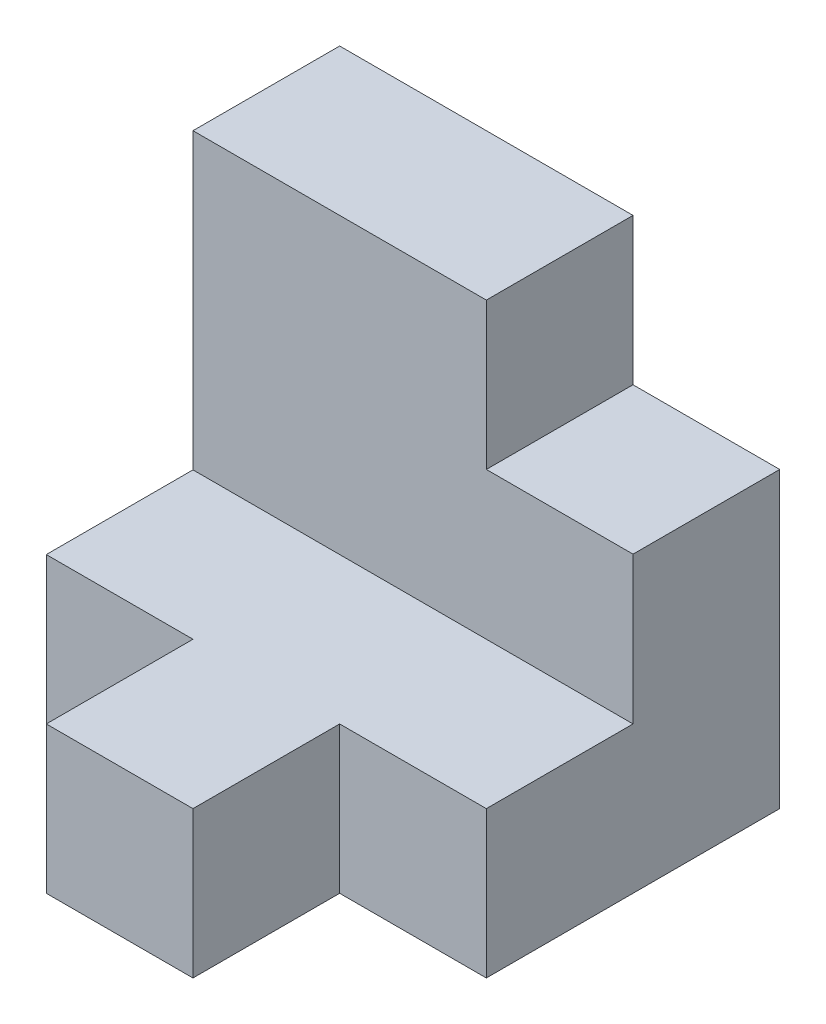
from build123d import *

# Parameters (mm, degrees)
ESBO_O2_W                = 60
ESBO_O2_H                = 20
RESSALTO_EXTRUS_O1_DEPTH = 40
ESBO_O4_W                = 20
ESBO_O4_H                = 20
CORTE_EXTRUS_O1_DEPTH    = 40
ESBO_O5_W                = 20
ESBO_O5_H                = 20
CORTE_EXTRUS_O2_DEPTH    = 40
ESBO_O7_W                = 60
ESBO_O7_H                = 40.049473908
RESSALTO_EXTRUS_O2_DEPTH = 20
ESBO_O8_W                = 40
ESBO_O8_H                = 20
RESSALTO_EXTRUS_O3_DEPTH = 20


with BuildPart() as part:
    # Esboço2 → Ressalto-extrusão1 (new body)
    with BuildSketch(Plane.XY):
        with Locations((30, 10)):
            Rectangle(ESBO_O2_W, ESBO_O2_H)
    extrude(amount=RESSALTO_EXTRUS_O1_DEPTH)

    # Esboço4 → Corte-extrusão1 (cut)
    with BuildSketch(Plane(origin=(0, 20, 0), x_dir=(1, 0, 0), z_dir=(0, 1, 0))):
        with Locations((10, -30)):
            Rectangle(ESBO_O4_W, ESBO_O4_H)
    extrude(amount=-CORTE_EXTRUS_O1_DEPTH, mode=Mode.SUBTRACT)

    # Esboço5 → Corte-extrusão2 (cut)
    with BuildSketch(Plane(origin=(0, 20, 0), x_dir=(1, 0, 0), z_dir=(0, 1, 0))):
        with Locations((50, -30)):
            Rectangle(ESBO_O5_W, ESBO_O5_H)
    extrude(amount=-CORTE_EXTRUS_O2_DEPTH, mode=Mode.SUBTRACT)

    # Esboço7 → Ressalto-extrusão2 (add)
    with BuildSketch(Plane(origin=(0, 0, 0), x_dir=(-1, 0, 0), z_dir=(0, 0, -1))):
        with Locations((-30, 20.024736954)):
            Rectangle(ESBO_O7_W, ESBO_O7_H)
    extrude(amount=RESSALTO_EXTRUS_O2_DEPTH)

    # Esboço8 → Ressalto-extrusão3 (add)
    with BuildSketch(Plane(origin=(0, 40.049473908, 0), x_dir=(1, 0, 0), z_dir=(0, 1, 0))):
        with Locations((20, 10)):
            Rectangle(ESBO_O8_W, ESBO_O8_H)
    extrude(amount=RESSALTO_EXTRUS_O3_DEPTH)


solid = part.part
